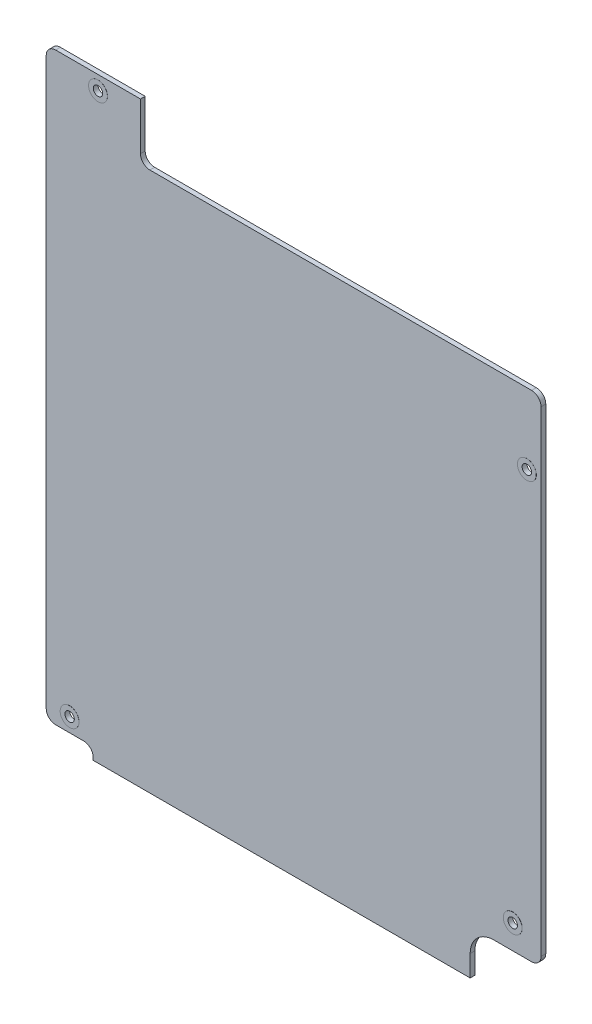
from build123d import *

# Parameters (mm, degrees)
BOSS_EXTRUDE1_DEPTH = 1
SKETCH2_R           = 1
CUT_EXTRUDE1_DEPTH  = 10
EXTRUDE_THIN1_START = 0.02
SKETCH3_R           = 2
SKETCH3_R_2         = 1
EXTRUDE_THIN1_DEPTH = 0.02


with BuildPart() as part:
    # Sketch1 → Boss-Extrude1 (new body)
    with BuildSketch(Plane.XY):
        with BuildLine():
            Line((50.5, 52.5), (-30.5, 52.5))
            ThreePointArc((-30.5, 52.5), (-31.914213562, 53.085786438), (-32.5, 54.5))
            Line((-32.5, 54.5), (-32.5, 64.55209468))
            Line((-32.5, 64.55209468), (-50.5, 64.55209468))
            ThreePointArc((-50.5, 64.55209468), (-51.914213562, 63.966308242), (-52.5, 62.55209468))
            Line((-52.5, 62.55209468), (-52.5, 52.5))
            Line((-52.5, 52.5), (-52.5, -52.5))
            Line((-52.5, -52.5), (-52.5, -57.44790532))
            ThreePointArc((-52.5, -57.44790532), (-51.914213562, -58.862118883), (-50.5, -59.44790532))
            Line((-50.5, -59.44790532), (-44.543708146, -59.44790532))
            ThreePointArc((-44.543708146, -59.44790532), (-43.129494584, -60.033691758), (-42.543708146, -61.44790532))
            Line((-42.543708146, -61.44790532), (-42.543708146, -62))
            Line((-42.543708146, -62), (37.456291854, -62))
            Line((37.456291854, -62), (37.456291854, -57.5))
            ThreePointArc((37.456291854, -57.5), (38.920757948, -53.964466094), (42.456291854, -52.5))
            Line((42.456291854, -52.5), (50.5, -52.5))
            ThreePointArc((50.5, -52.5), (51.914213562, -51.914213562), (52.5, -50.5))
            Line((52.5, -50.5), (52.5, 50.5))
            ThreePointArc((52.5, 50.5), (51.914213562, 51.914213562), (50.5, 52.5))
        make_face()
    extrude(amount=BOSS_EXTRUDE1_DEPTH)

    # Sketch2 → Cut-Extrude1 (cut)
    with BuildSketch(Plane.XY.offset(1)):
        with Locations((-41.5, 61.55209468)):
            Circle(SKETCH2_R)
        with Locations((-47.521854073, -56.44790532)):
            Circle(SKETCH2_R)
        with Locations((49.5, 37.474161099)):
            Circle(SKETCH2_R)
        with Locations((46.5, -47.340248832)):
            Circle(SKETCH2_R)
    extrude(amount=-CUT_EXTRUDE1_DEPTH, mode=Mode.SUBTRACT)

    # Sketch3 → Extrude-Thin1 (add)
    # profile 1 of 4: a face of its own
    with BuildSketch(Plane.XY.offset(1).offset(EXTRUDE_THIN1_START)):
        with Locations((-47.521854073, -56.44790532)):
            Circle(SKETCH3_R)
        with Locations((-47.521854073, -56.44790532)):
            Circle(SKETCH3_R_2, mode=Mode.SUBTRACT)
    # profile 2 of 4: a face of its own
    with BuildSketch(Plane.XY.offset(1).offset(EXTRUDE_THIN1_START)):
        with Locations((-41.5, 61.55209468)):
            Circle(SKETCH3_R)
        with Locations((-41.5, 61.55209468)):
            Circle(SKETCH3_R_2, mode=Mode.SUBTRACT)
    # profile 3 of 4: a face of its own
    with BuildSketch(Plane.XY.offset(1).offset(EXTRUDE_THIN1_START)):
        with Locations((49.5, 37.474161099)):
            Circle(SKETCH3_R)
        with Locations((49.5, 37.474161099)):
            Circle(SKETCH3_R_2, mode=Mode.SUBTRACT)
    # profile 4 of 4: a face of its own
    with BuildSketch(Plane.XY.offset(1).offset(EXTRUDE_THIN1_START)):
        with Locations((46.5, -47.340248832)):
            Circle(SKETCH3_R)
        with Locations((46.5, -47.340248832)):
            Circle(SKETCH3_R_2, mode=Mode.SUBTRACT)
    extrude(amount=-EXTRUDE_THIN1_DEPTH)


solid = part.part
